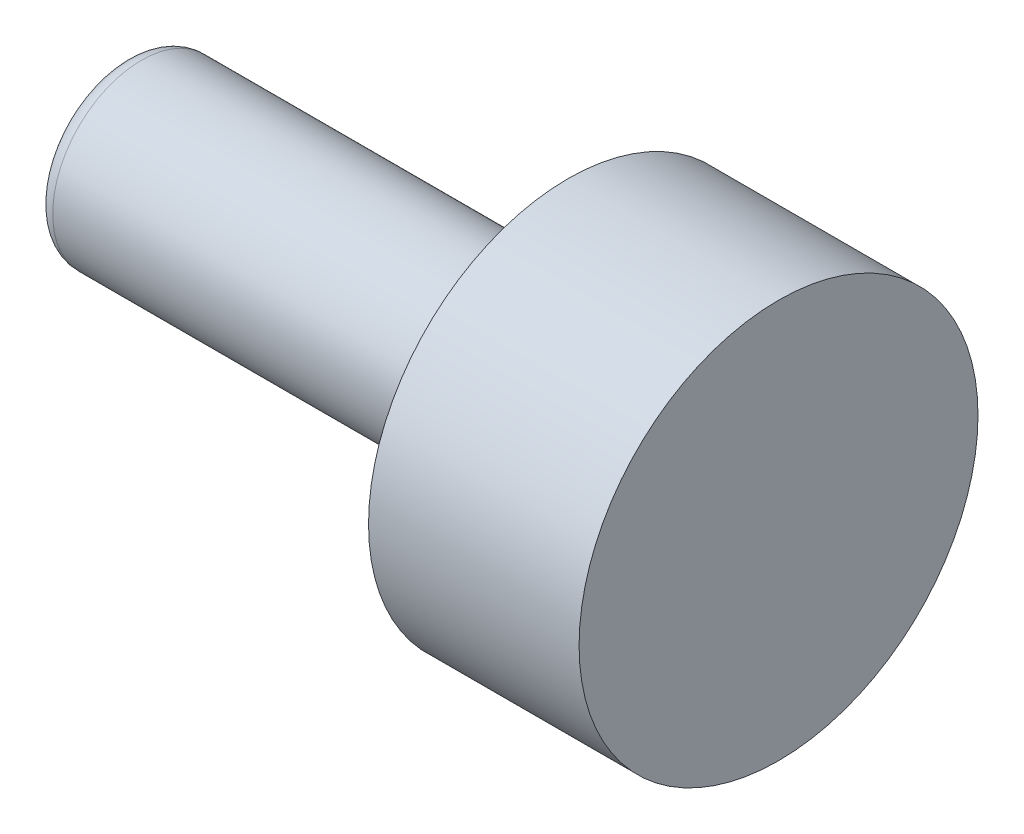
from build123d import *

# Parameters (mm, degrees)
SKETCH3_R           = 16
BOSS_EXTRUDE1_DEPTH = 80
SKETCH4_R           = 36
BOSS_EXTRUDE2_DEPTH = 38
FILLET1_R           = 3


with BuildPart() as part:
    # Sketch3 → Boss-Extrude1 (new body)
    with BuildSketch(Plane(origin=(0, 0, 0), x_dir=(0, 0, -1), z_dir=(1, 0, 0))):
        Circle(SKETCH3_R)
    extrude(amount=BOSS_EXTRUDE1_DEPTH)

    # Sketch4 → Boss-Extrude2 (add)
    with BuildSketch(Plane(origin=(80, 0, 0), x_dir=(0, 0, -1), z_dir=(1, 0, 0))):
        Circle(SKETCH4_R)
    extrude(amount=BOSS_EXTRUDE2_DEPTH)

    # Fillet1
    fillet1_edges = [part.edges().sort_by_distance(p)[0] for p in [
        (0, 0, 16),
        (80, 0, 16),
    ]]
    fillet(fillet1_edges, radius=FILLET1_R)


solid = part.part
